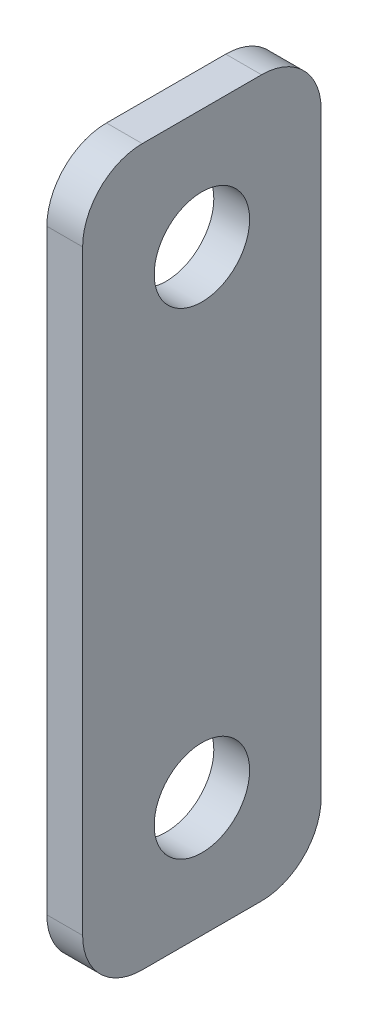
from build123d import *

# Parameters (mm, degrees)
SKETCH1_W           = 20
SKETCH1_H           = 60
SKETCH1_R           = 4
BOSS_EXTRUDE1_DEPTH = 3
FILLET1_R           = 5


with BuildPart() as part:
    # Sketch1 → Boss-Extrude1 (new body)
    with BuildSketch(Plane(origin=(0, 0, 0), x_dir=(0, 0, -1), z_dir=(1, 0, 0))):
        with Locations((10, 30)):
            Rectangle(SKETCH1_W, SKETCH1_H)
        with Locations((10, 50)):
            Circle(SKETCH1_R, mode=Mode.SUBTRACT)
        with Locations((10, 10)):
            Circle(SKETCH1_R, mode=Mode.SUBTRACT)
    extrude(amount=BOSS_EXTRUDE1_DEPTH)

    # Fillet1
    fillet1_edges = [part.edges().sort_by_distance(p)[0] for p in [
        (1.5, 60, 0),
        (1.5, 60, -20),
        (1.5, 0, -20),
        (1.5, 0, 0),
    ]]
    fillet(fillet1_edges, radius=FILLET1_R)


solid = part.part
